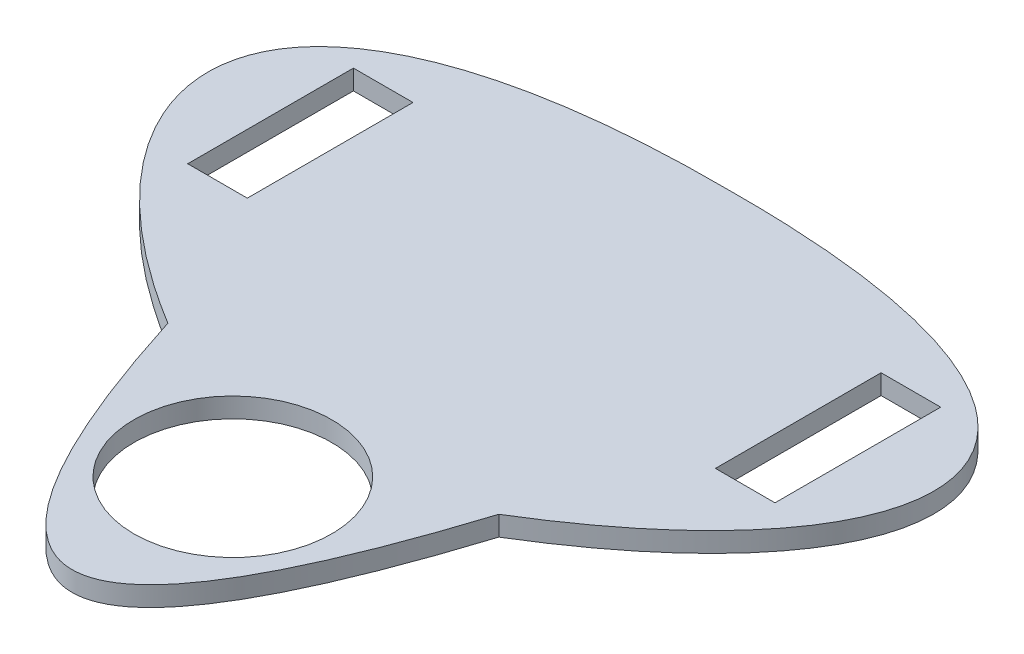
from build123d import *

# Parameters (mm, degrees)
SKETCH1_R           = 15
SKETCH1_W           = 9.033789511
SKETCH1_H           = 25.11797261
BOSS_EXTRUDE1_DEPTH = 3


with BuildPart() as part:
    # Sketch1 → Boss-Extrude1 (new body)
    with BuildSketch(Plane(origin=(0, 0, 0), x_dir=(1, 0, 0), z_dir=(0, 1, 0))):
        with BuildLine():
            add(Edge.make_bspline(
                [(-25.850267552, 0), (-0.763553632, -79.235152429), (24.323160288, 0)],
                knots=[0, 0, 0, 1, 1, 1], degree=2))
            add(Edge.make_bspline(
                [(24.323160288, 0), (67.143381198, 26.049823561), (68.440320284, 60.482028786), (-0.763553632, 60)],
                knots=[0, 0, 0, 0, 1, 1, 1, 1], degree=3))
            add(Edge.make_bspline(
                [(-25.850267552, 0), (-68.670488462, 26.049823561), (-69.967427548, 60.482028786), (-0.763553632, 60)],
                knots=[0, 0, 0, 0, 1, 1, 1, 1], degree=3))
        make_face()
        with Locations(Location((-0.763553632, -15.237324398, 0), (0, 0, 270))):
            Circle(SKETCH1_R, mode=Mode.SUBTRACT)
        with Locations((39.236446368, 35)):
            Rectangle(SKETCH1_W, SKETCH1_H, mode=Mode.SUBTRACT)
        with Locations((-40.763553633, 35)):
            Rectangle(SKETCH1_W, SKETCH1_H, mode=Mode.SUBTRACT)
    extrude(amount=BOSS_EXTRUDE1_DEPTH)


solid = part.part
